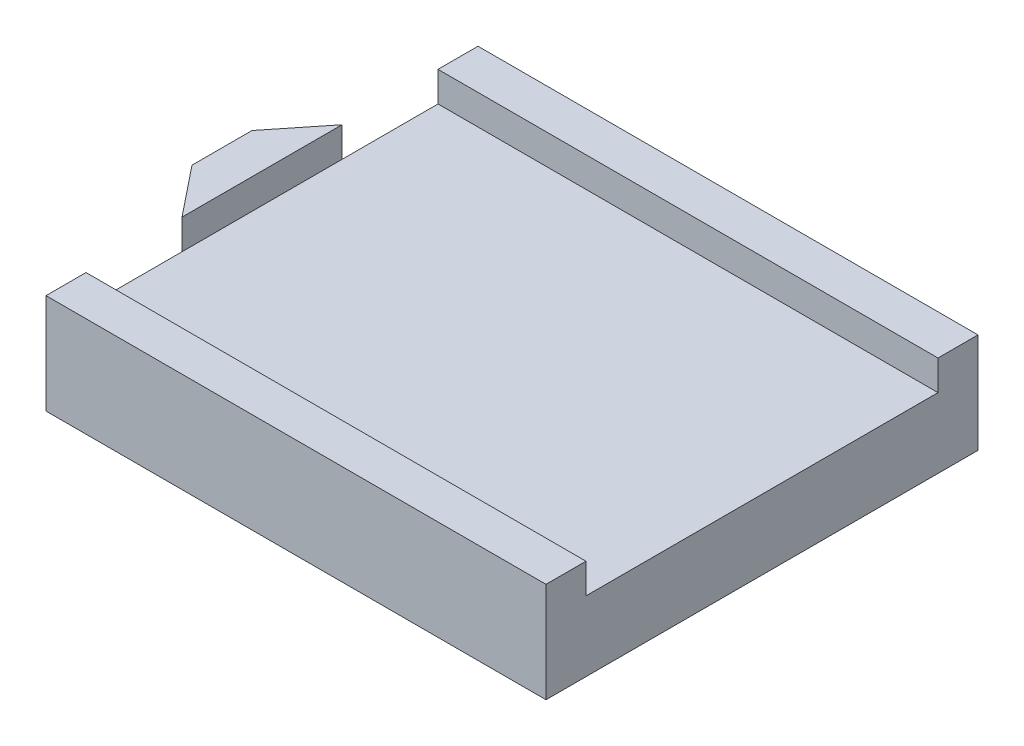
from build123d import *

# Parameters (mm, degrees)
RESSALTO_EXTRUS_O1_DEPTH = 3.5
ESBO_O1_3_W              = 25
ESBO_O1_3_H              = 2
RESSALTO_EXTRUS_O2_DEPTH = 5
ESBO_O2_R                = 1.55
CORTE_EXTRUS_O1_DEPTH    = 2.2


with BuildPart() as part:
    # Esboço1 → Ressalto-extrusão1 (new body)
    with BuildSketch(Plane(origin=(0, 0, 0), x_dir=(1, 0, 0), z_dir=(0, 1, 0))):
        Polygon((12.5, -8.8), (12.5, 8.8), (-12.5, 8.8), (-12.5, 4), (-12.5, 1.5), (-12.5, -1.5), (-12.5, -4), (-12.5, -8.8), align=None)
    extrude(amount=RESSALTO_EXTRUS_O1_DEPTH)

    # Esboço1<3> → Ressalto-extrusão2 (add)
    with BuildSketch(Plane(origin=(0, 0, 0), x_dir=(1, 0, 0), z_dir=(0, 1, 0))):
        with Locations((0, 9.8)):
            Rectangle(ESBO_O1_3_W, ESBO_O1_3_H)
        with Locations((0, -9.8)):
            Rectangle(ESBO_O1_3_W, ESBO_O1_3_H)
        Polygon((-12.5, 4), (-14.5, 1.5), (-14.5, -1.5), (-12.5, -4), align=None)
    extrude(amount=RESSALTO_EXTRUS_O2_DEPTH)

    # Esboço2 → Corte-extrusão1 (cut)
    with BuildSketch(Plane.XZ):
        with Locations((8.5, 7.8)):
            Circle(ESBO_O2_R)
        with Locations((-8.5, 7.8)):
            Circle(ESBO_O2_R)
        with Locations((-8.5, -7.8)):
            Circle(ESBO_O2_R)
        with Locations((8.5, -7.8)):
            Circle(ESBO_O2_R)
    extrude(amount=-CORTE_EXTRUS_O1_DEPTH, mode=Mode.SUBTRACT)


solid = part.part
